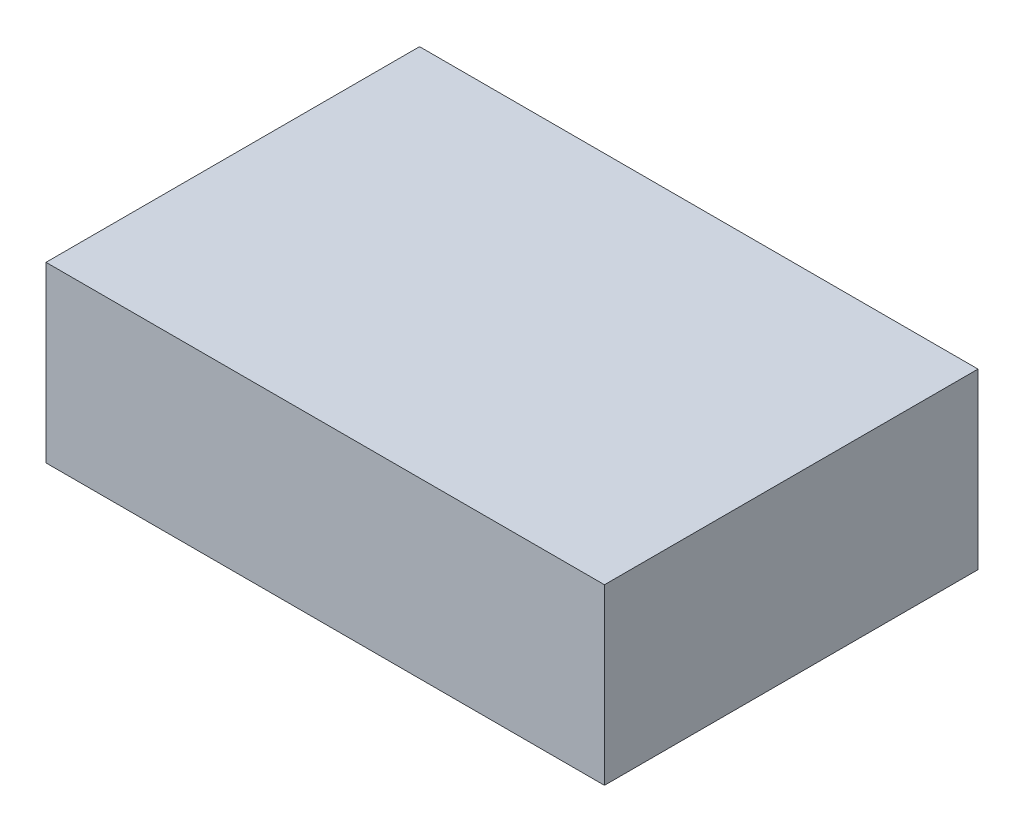
from build123d import *

# Parameters (mm, degrees)
SKETCH1_W           = 90
SKETCH1_H           = 60.2
BOSS_EXTRUDE1_DEPTH = 28


with BuildPart() as part:
    # Sketch1 → Boss-Extrude1 (new body)
    with BuildSketch(Plane(origin=(0, 0, 0), x_dir=(1, 0, 0), z_dir=(0, 1, 0))):
        Rectangle(SKETCH1_W, SKETCH1_H)
    extrude(amount=BOSS_EXTRUDE1_DEPTH)


solid = part.part
